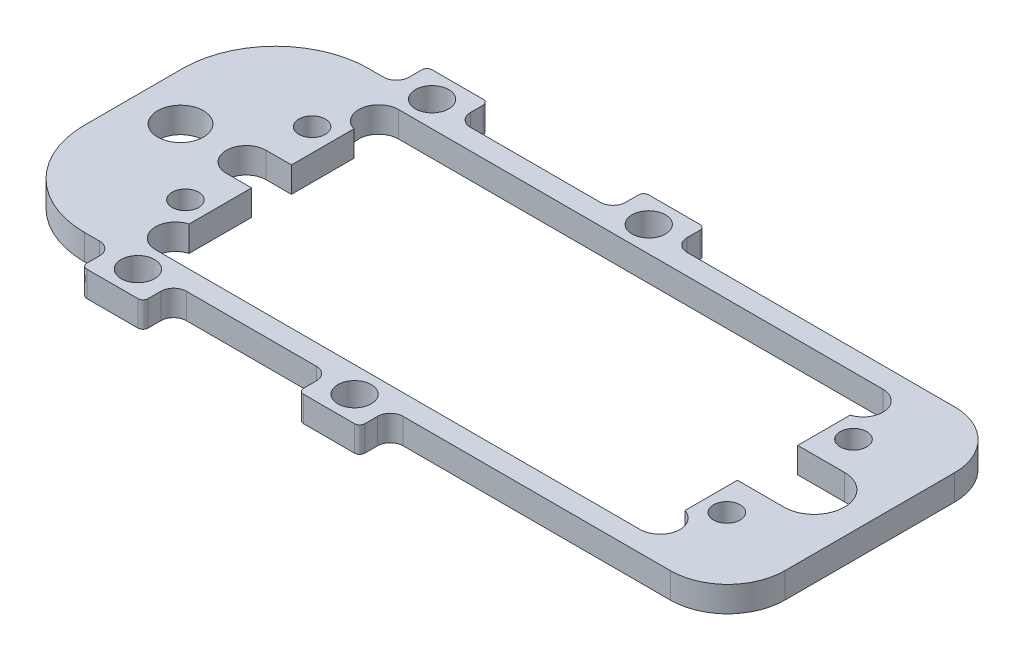
from build123d import *

# Parameters (mm, degrees)
CROQUIS1_R                 = 1.35255
CROQUIS1_R_2               = 1.778
SALIENTE_EXTRUIR1_DEPTH    = 3.175
CROQUIS5_R                 = 2.55
CORTAR_EXTRUIR1_DEPTH      = 53.649355209
CORTAR_EXTRUIR2_DEPTH      = 53.649355209
CORTAR_EXTRUIR2_DEPTH_BACK = 53.649355209
CROQUIS10_R                = 2.078
CROQUIS10_R_2              = 1.65255
CROQUIS10_R_3              = 2.85
CORTAR_EXTRUIR3_DEPTH      = 53.649355209


with BuildPart() as part:
    # Croquis1 → Saliente-Extruir1 (new body)
    with BuildSketch(Plane.XZ):
        with BuildLine():
            Line((-6.02234, -19.2405), (-6.02234, -20.828))
            ThreePointArc((-6.02234, -20.828), (-5.836352806, -21.277012806), (-5.38734, -21.463))
            Line((-5.38734, -21.463), (0.96266, -21.463))
            ThreePointArc((0.96266, -21.463), (1.411672806, -21.277012806), (1.59766, -20.828))
            Line((1.59766, -20.828), (1.59766, -19.2405))
            ThreePointArc((1.59766, -19.2405), (2.062627985, -18.117967985), (3.18516, -17.653))
            Line((3.18516, -17.653), (36.43122, -17.653))
            ThreePointArc((36.43122, -17.653), (41.454190356, -15.572417555), (43.534772801, -10.549447199))
            Line((43.534772801, -10.549447199), (43.534772801, 10.549447199))
            ThreePointArc((43.534772801, 10.549447199), (41.454190356, 15.572417555), (36.43122, 17.653))
            Line((36.43122, 17.653), (3.18516, 17.653))
            ThreePointArc((3.18516, 17.653), (2.062627985, 18.117967985), (1.59766, 19.2405))
            Line((1.59766, 19.2405), (1.59766, 20.828))
            ThreePointArc((1.59766, 20.828), (1.411672806, 21.277012806), (0.96266, 21.463))
            Line((0.96266, 21.463), (-5.38734, 21.463))
            ThreePointArc((-5.38734, 21.463), (-5.836352806, 21.277012806), (-6.02234, 20.828))
            Line((-6.02234, 20.828), (-6.02234, 19.2405))
            ThreePointArc((-6.02234, 19.2405), (-6.487307985, 18.117967985), (-7.60984, 17.653))
            Line((-7.60984, 17.653), (-23.755604, 17.653))
            ThreePointArc((-23.755604, 17.653), (-24.878136015, 18.117967985), (-25.343104, 19.2405))
            Line((-25.343104, 19.2405), (-25.343104, 20.828))
            ThreePointArc((-25.343104, 20.828), (-25.529091194, 21.277012806), (-25.978104, 21.463))
            Line((-25.978104, 21.463), (-32.328104, 21.463))
            ThreePointArc((-32.328104, 21.463), (-32.777116806, 21.277012806), (-32.963104, 20.828))
            Line((-32.963104, 20.828), (-32.963104, 19.2405))
            ThreePointArc((-32.963104, 19.2405), (-33.428071985, 18.117967985), (-34.550604, 17.653))
            Line((-34.550604, 17.653), (-36.43122, 17.653))
            ThreePointArc((-36.43122, 17.653), (-44.591052878, 14.273086555), (-47.970966323, 6.113253677))
            Line((-47.970966323, 6.113253677), (-47.970966323, -6.113253677))
            ThreePointArc((-47.970966323, -6.113253677), (-44.591052878, -14.273086555), (-36.43122, -17.653))
            Line((-36.43122, -17.653), (-34.550604, -17.653))
            ThreePointArc((-34.550604, -17.653), (-33.428071985, -18.117967985), (-32.963104, -19.2405))
            Line((-32.963104, -19.2405), (-32.963104, -20.828))
            ThreePointArc((-32.963104, -20.828), (-32.777116806, -21.277012806), (-32.328104, -21.463))
            Line((-32.328104, -21.463), (-25.978104, -21.463))
            ThreePointArc((-25.978104, -21.463), (-25.529091194, -21.277012806), (-25.343104, -20.828))
            Line((-25.343104, -20.828), (-25.343104, -19.2405))
            ThreePointArc((-25.343104, -19.2405), (-24.878136015, -18.117967985), (-23.755604, -17.653))
            Line((-23.755604, -17.653), (-7.60984, -17.653))
            ThreePointArc((-7.60984, -17.653), (-6.487307985, -18.117967985), (-6.02234, -19.2405))
        make_face()
        with Locations(Location((33.655, -7.874, 0), (0, 0, 90))):
            Circle(CROQUIS1_R, mode=Mode.SUBTRACT)
        with Locations(Location((-33.655, 7.874, 0), (0, 0, 90))):
            Circle(CROQUIS1_R, mode=Mode.SUBTRACT)
        with Locations(Location((-33.655, -7.874, 0), (0, 0, 90))):
            Circle(CROQUIS1_R, mode=Mode.SUBTRACT)
        with Locations(Location((-2.21234, 18.288, 0), (0, 0, 90))):
            Circle(CROQUIS1_R_2, mode=Mode.SUBTRACT)
        with Locations(Location((-29.153104, -18.288, 0), (0, 0, 90))):
            Circle(CROQUIS1_R_2, mode=Mode.SUBTRACT)
        with Locations(Location((-2.21234, -18.288, 0), (0, 0, 90))):
            Circle(CROQUIS1_R_2, mode=Mode.SUBTRACT)
        with Locations(Location((-29.153104, 18.288, 0), (0, 0, 90))):
            Circle(CROQUIS1_R_2, mode=Mode.SUBTRACT)
        with Locations(Location((33.655, 7.874, 0), (0, 0, 90))):
            Circle(CROQUIS1_R, mode=Mode.SUBTRACT)
        with BuildLine():
            Line((-33.9725, 2.4765), (-30.827491336, 2.4765))
            Line((-30.827491336, 2.4765), (-30.827491336, 10.246241112))
            ThreePointArc((-30.827491336, 10.246241112), (-32.595430826, 12.971859774), (-30.143156557, 15.102812154))
            Line((-30.143156557, 15.102812154), (30.102172211, 15.102812154))
            ThreePointArc((30.102172211, 15.102812154), (32.54999843, 13.002076782), (30.845, 10.263843291))
            Line((30.845, 10.263843291), (30.845, 2.4765))
            Line((30.845, 2.4765), (33.9725, 2.4765))
            ThreePointArc((33.9725, 2.4765), (36.449, 0), (33.9725, -2.4765))
            Line((33.9725, -2.4765), (30.845, -2.4765))
            Line((30.845, -2.4765), (30.845, -10.263843291))
            ThreePointArc((30.845, -10.263843291), (32.539365892, -13.004061323), (30.092328369, -15.099694402))
            Line((30.092328369, -15.099694402), (-30.132404788, -15.099694402))
            ThreePointArc((-30.132404788, -15.099694402), (-32.583891793, -12.974283727), (-30.827491336, -10.246241112))
            Line((-30.827491336, -10.246241112), (-30.827491336, -2.4765))
            Line((-30.827491336, -2.4765), (-33.9725, -2.4765))
            ThreePointArc((-33.9725, -2.4765), (-36.449, 0), (-33.9725, 2.4765))
        make_face(mode=Mode.SUBTRACT)
    extrude(amount=-SALIENTE_EXTRUIR1_DEPTH)

    # Croquis5 → Cortar-Extruir1 (cut, through all)
    with BuildSketch(Plane(origin=(0, 3.175, 0), x_dir=(1, 0, 0), z_dir=(0, 1, 0))):
        with Locations(Location((-42.138904379, 0, 0), (0, 0, 270))):
            Circle(CROQUIS5_R)
    extrude(amount=-CORTAR_EXTRUIR1_DEPTH, mode=Mode.SUBTRACT)

    # Croquis9 → Cortar-Extruir2 (cut, two sides: drawn at the far end of the back side and taken through both)
    with BuildSketch(Plane(origin=(0, 3.175, 0), x_dir=(1, 0, 0), z_dir=(0, 1, 0)).offset(-CORTAR_EXTRUIR2_DEPTH_BACK)):
        with BuildLine():
            Line((30.845, -2.4765), (30.845, -3.75))
            Line((30.845, -3.75), (36.645, -3.75))
            ThreePointArc((36.645, -3.75), (40.395, 0), (36.645, 3.75))
            Line((36.645, 3.75), (30.845, 3.75))
            Line((30.845, 3.75), (30.845, 2.4765))
            Line((30.845, 2.4765), (33.9725, 2.4765))
            ThreePointArc((33.9725, 2.4765), (36.449, 0), (33.9725, -2.4765))
            Line((33.9725, -2.4765), (30.845, -2.4765))
        make_face()
    extrude(amount=CORTAR_EXTRUIR2_DEPTH + CORTAR_EXTRUIR2_DEPTH_BACK, mode=Mode.SUBTRACT)

    # Croquis10 → Cortar-Extruir3 (cut, through all)
    with BuildSketch(Plane(origin=(0, 3.175, 0), x_dir=(1, 0, 0), z_dir=(0, 1, 0))):
        with Locations(Location((-29.153104, 18.288, 0), (0, 0, 270))):
            Circle(CROQUIS10_R)
        with Locations(Location((-33.655, 7.874, 0), (0, 0, 270))):
            Circle(CROQUIS10_R_2)
        with Locations(Location((-42.138904379, 0, 0), (0, 0, 270))):
            Circle(CROQUIS10_R_3)
        with Locations(Location((-33.655, -7.874, 0), (0, 0, 270))):
            Circle(CROQUIS10_R_2)
        with Locations(Location((-29.153104, -18.288, 0), (0, 0, 270))):
            Circle(CROQUIS10_R)
        with Locations(Location((-2.21234, -18.288, 0), (0, 0, 270))):
            Circle(CROQUIS10_R)
        with Locations(Location((-2.21234, 18.288, 0), (0, 0, 270))):
            Circle(CROQUIS10_R)
        with Locations(Location((33.655, 7.874, 0), (0, 0, 270))):
            Circle(CROQUIS10_R_2)
        with Locations(Location((33.655, -7.874, 0), (0, 0, 270))):
            Circle(CROQUIS10_R_2)
    extrude(amount=-CORTAR_EXTRUIR3_DEPTH, mode=Mode.SUBTRACT)


solid = part.part
